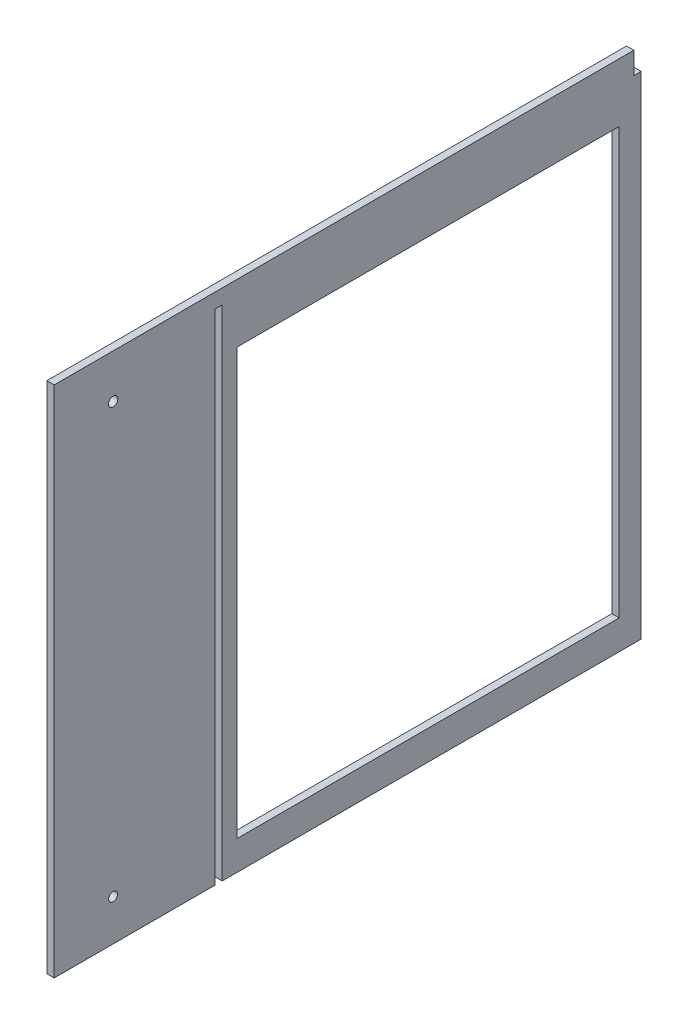
from build123d import *

# Parameters (mm, degrees)
CROQUIS1_W              = 5
CROQUIS1_H              = 350
SALIENTE_EXTRUIR1_DEPTH = 400
CROQUIS2_W              = 5
CROQUIS2_H              = 340
CROQUIS2_W_2            = 260.5
CROQUIS2_H_2            = 290
CROQUIS2_H_3            = 15
CORTAR_EXTRUIR1_DEPTH   = 30
CROQUIS3_R              = 3.175
CROQUIS3_R_2            = 3.05
CORTAR_EXTRUIR2_DEPTH   = 10


with BuildPart() as part:
    # Croquis1 → Saliente-Extruir1 (new body)
    with BuildSketch(Plane.XY):
        with Locations((-328.734660689, -84.960159363)):
            Rectangle(CROQUIS1_W, CROQUIS1_H)
    extrude(amount=-SALIENTE_EXTRUIR1_DEPTH)

    # Croquis2 → Cortar-Extruir1 (cut)
    with BuildSketch(Plane.ZY.offset(331.234660689)):
        with Locations((-112, -89.960159363)):
            Rectangle(CROQUIS2_W, CROQUIS2_H)
        with Locations((-254.75, -94.960159363)):
            Rectangle(CROQUIS2_W_2, CROQUIS2_H_2)
        with Locations((-397.5, 82.539840637)):
            Rectangle(CROQUIS2_W, CROQUIS2_H_3)
    extrude(amount=-CORTAR_EXTRUIR1_DEPTH, mode=Mode.SUBTRACT)

    # Croquis3 → Cortar-Extruir2 (cut)
    with BuildSketch(Plane.ZY.offset(331.234660689)):
        with Locations((-40.18483097, 60.17469511)):
            Circle(CROQUIS3_R)
        with Locations((-40.18483097, -232.010159363)):
            Circle(CROQUIS3_R_2)
    extrude(amount=-CORTAR_EXTRUIR2_DEPTH, mode=Mode.SUBTRACT)


solid = part.part
